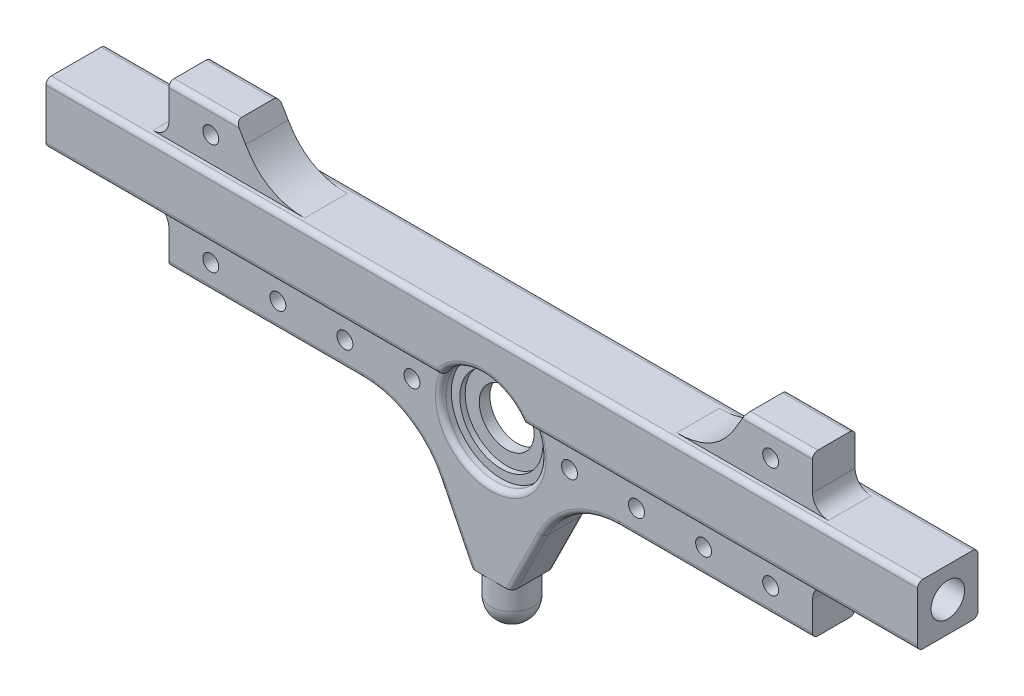
from build123d import *

# Parameters (mm, degrees)
SKETCH2_W           = 18
SKETCH2_H           = 18
BOSS_EXTRUDE2_DEPTH = 130
BOSS_EXTRUDE3_DEPTH = 6.35
SKETCH11_W          = 73.448818898
SKETCH11_H          = 15
SKETCH11_W_2        = 192
BOSS_EXTRUDE6_DEPTH = 12.7
SKETCH13_R          = 2.38125
CUT_EXTRUDE3_DEPTH  = 14.27
FILLET4_R           = 25.4
SKETCH6_R           = 5
CUT_EXTRUDE4_DEPTH  = 100
SKETCH16_R          = 1.905
CUT_EXTRUDE7_DEPTH  = 25
FILLET7_R           = 1.5875
FILLET8_R           = 1.5875
FILLET15_R          = 4.7625
CUT_EXTRUDE8_DEPTH  = 145.401330081


with BuildPart() as part:
    # Sketch2 → Boss-Extrude2 (new, symmetric)
    with BuildSketch(Plane(origin=(0, 0, 0), x_dir=(0, 0, -1), z_dir=(1, 0, 0))):
        with Locations((0, 9)):
            Rectangle(SKETCH2_W, SKETCH2_H)
    extrude(amount=BOSS_EXTRUDE2_DEPTH, both=True)

    # Sketch3 → Boss-Extrude3 (add, symmetric)
    with BuildSketch(Plane.XY):
        Polygon((-6.35, -47.625), (6.35, -47.625), (30, 0), (-30, 0), align=None)
    extrude(amount=BOSS_EXTRUDE3_DEPTH, both=True)

    # Sketch4 → Cut-Revolve1 (revolve, cut)
    with BuildSketch(Plane(origin=(0, -8.255, 0), x_dir=(-1, 0, 0), z_dir=(0, -1, 0))):
        Polygon((10.153399538, 1.5875), (11.6205, 1.5875), (12.3825, 1.5875), (12.3825, 1.778), (12.3825, 2.667), (12.3825, 3.175), (12.6365, 3.175), (14.1605, 3.175), (14.9225, 3.175), (14.9225, 3.683), (14.9225, 9.0424), (0, 9.0424), (0, -9.0424), (14.9225, -9.0424), (14.9225, -3.683), (14.9225, -3.175), (14.1605, -3.175), (12.6365, -3.175), (12.3825, -3.175), (12.3825, -2.667), (12.3825, -1.778), (12.3825, -1.5875), (11.6205, -1.5875), (10.153399538, -1.5875), (8.1915, -1.5875), (8.1915, 1.5875), align=None)
    revolve(axis=Axis((0, -8.255, -9.0424), (0, 0, 1)), mode=Mode.SUBTRACT)

    # Sketch11 → Boss-Extrude6 (add)
    with BuildSketch(Plane.XY.offset(6.35)):
        with Locations((-59.275590551, -7.5)):
            Rectangle(SKETCH11_W, SKETCH11_H)
        with Locations((0, 25.5)):
            Rectangle(SKETCH11_W_2, SKETCH11_H)
        with Locations((59.275590551, -7.5)):
            Rectangle(SKETCH11_W, SKETCH11_H)
    extrude(amount=-BOSS_EXTRUDE6_DEPTH)

    # Sketch12 → Revolve2 (revolve)
    with BuildSketch(Plane.XY):
        with BuildLine():
            Line((0, -47.625), (6.35, -47.625))
            Line((6.35, -47.625), (6.35, -54.61))
            ThreePointArc((6.35, -54.61), (4.490128061, -59.100128061), (0, -60.96))
            Line((0, -60.96), (0, -47.625))
        make_face()
    revolve(axis=Axis((0, -54.61, 0), (0, -1, 0)))

    # Sketch13 → Cut-Extrude3 (cut)
    with BuildSketch(Plane.XY.offset(6.35)):
        with Locations((83.5, -7.5)):
            Circle(SKETCH13_R)
        with Locations((63.5, -7.5)):
            Circle(SKETCH13_R)
        with Locations((43.5, -7.5)):
            Circle(SKETCH13_R)
        with Locations((23.5, -7.5)):
            Circle(SKETCH13_R)
        with Locations((-83.5, -7.5)):
            Circle(SKETCH13_R)
        with Locations((-63.5, -7.5)):
            Circle(SKETCH13_R)
        with Locations((-43.5, -7.5)):
            Circle(SKETCH13_R)
        with Locations((-23.5, -7.5)):
            Circle(SKETCH13_R)
        with Locations((-83.5, 25.5)):
            Circle(SKETCH13_R)
        with Locations((83.5, 25.5)):
            Circle(SKETCH13_R)
    extrude(amount=-CUT_EXTRUDE3_DEPTH, mode=Mode.SUBTRACT)

    # Fillet4
    fillet4_edges = [part.edges().sort_by_distance(p)[0] for p in [
        (22.551181102, -15, 0),
        (-22.551181102, -15, 0),
    ]]
    fillet(fillet4_edges, radius=FILLET4_R)

    # Sketch6 → Cut-Extrude4 (cut)
    with BuildSketch(Plane(origin=(130, 0, 0), x_dir=(0, 0, -1), z_dir=(1, 0, 0))):
        with Locations((0, 9)):
            Circle(SKETCH6_R)
    cut_extrude4 = extrude(amount=-CUT_EXTRUDE4_DEPTH, mode=Mode.SUBTRACT)

    # Sketch16 → Cut-Extrude7 (cut)
    with BuildSketch(Plane.XZ.offset(15)):
        with Locations((90, 0)):
            Circle(SKETCH16_R)
        with Locations((53, 0)):
            Circle(SKETCH16_R)
    cut_extrude7 = extrude(amount=-CUT_EXTRUDE7_DEPTH, mode=Mode.SUBTRACT)

    # Fillet7
    fillet7_edges = [part.edges().sort_by_distance(p)[0] for p in [
        (10.948921831, -38.363957625, -6.35),
        (-10.948921831, -38.363957625, 6.35),
        (-10.948921831, -38.363957625, -6.35),
        (10.948921831, -38.363957625, 6.35),
        (-24.914171289, -18.811739849, 6.35),
        (-24.914171289, -18.811739849, -6.35),
        (24.914171289, -18.811739849, 6.35),
        (24.914171289, -18.811739849, -6.35),
        (-67.148629257, -15, 6.35),
        (67.148629257, -15, -6.35),
        (0, 33, -6.35),
        (67.148629257, -15, 6.35),
        (-67.148629257, -15, -6.35),
        (0, 33, 6.35),
    ]]
    fillet(fillet7_edges, radius=FILLET7_R)

    # Fillet8
    fillet8_edges = [part.edges().sort_by_distance(p)[0] for p in [
        (4.311361462, -22.541118038, -6.35),
        (4.311361462, -22.541118038, 6.35),
        (-71.215625094, 0, -9),
        (-71.215625094, 0, 9),
        (0, 6.6675, 9),
        (0, 6.6675, -9),
        (0, 18, 9),
        (0, 18, -9),
        (71.215625094, 0, -9),
        (71.215625094, 0, 9),
    ]]
    fillet(fillet8_edges, radius=FILLET8_R)

    # Mirror1: Cut-Extrude4, Cut-Extrude7 across plane
    add(cut_extrude4.mirror(Plane(origin=(0, 0, 0), x_dir=(0, 0, 1), z_dir=(1, 0, 0))), mode=Mode.SUBTRACT)
    add(cut_extrude7.mirror(Plane(origin=(0, 0, 0), x_dir=(0, 0, 1), z_dir=(1, 0, 0))), mode=Mode.SUBTRACT)

    # Fillet15
    fillet15_edges = [part.edges().sort_by_distance(p)[0] for p in [
        (96, 18, 0),
        (-96, 18, 0),
        (-96, 0, 0),
        (96, 0, 0),
    ]]
    fillet(fillet15_edges, radius=FILLET15_R)

    # Sketch17 → Cut-Extrude8 (cut, through all)
    with BuildSketch(Plane(origin=(0, 0, -6.35), x_dir=(-1, 0, 0), z_dir=(0, 0, -1))):
        with BuildLine():
            Line((-75.91, 33), (-73.12076932, 28.168910748))
            add(Edge.make_bspline(
                [(-55.494830626, 18), (-67.249745962, 18), (-73.12076932, 28.168910748)],
                knots=[0.154212769, 0.154212769, 0.154212769, 1, 1, 1], degree=2))
            Line((-55.494830626, 18), (55.494830697, 18))
            add(Edge.make_bspline(
                [(55.494830697, 18), (67.24974598, 18.000000031), (73.12076932, 28.168910748)],
                knots=[0.154212771, 0.154212771, 0.154212771, 1, 1, 1], degree=2))
            Line((73.12076932, 28.168910748), (75.91, 33))
            Line((75.91, 33), (-75.91, 33))
        make_face()
    extrude(amount=-CUT_EXTRUDE8_DEPTH, mode=Mode.SUBTRACT)


solid = part.part
